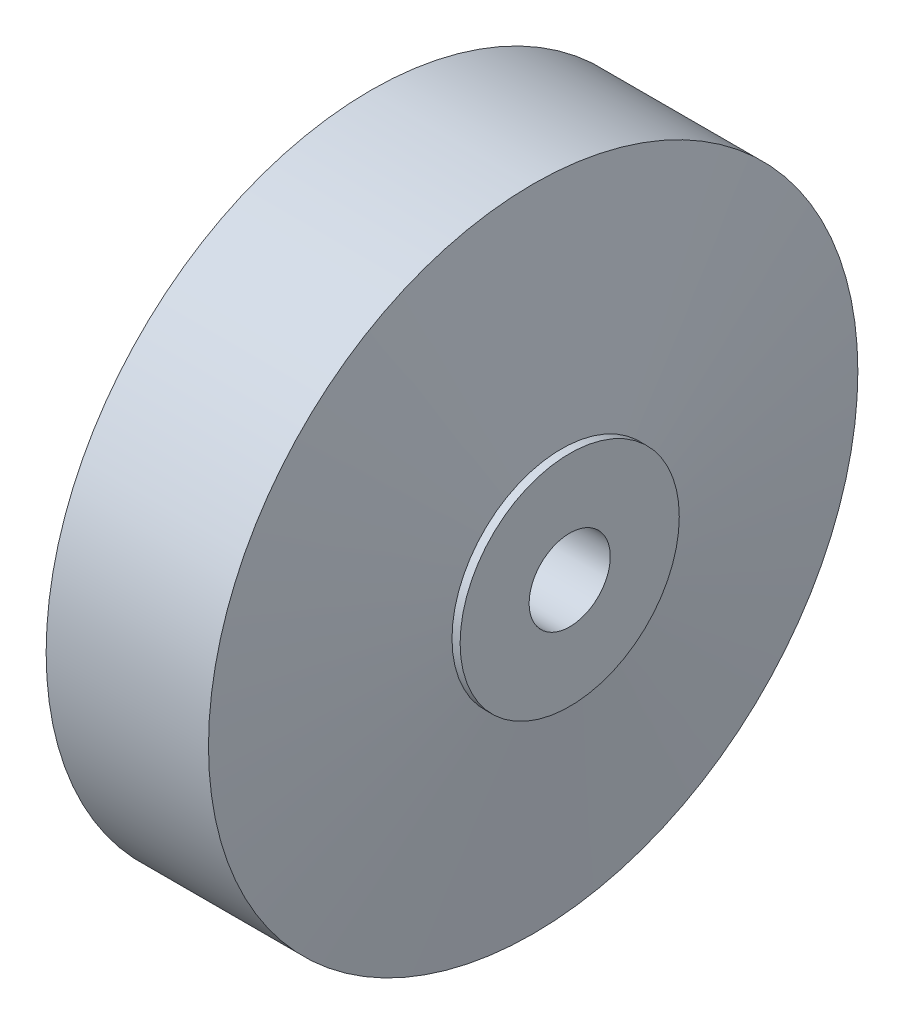
from build123d import *


with BuildPart() as part:
    # Esquisse1 → Révolution1 (revolve)
    with BuildSketch(Plane.XY, mode=Mode.PRIVATE) as r_volution1_sk:
        Polygon((-20, 80), (20, 80), (27, 27), (29, 27), (29, 10), (-29, 10), (-29, 27), (-27, 27), align=None)
    revolve(r_volution1_sk.sketch.rotate(Axis((0, 0, 0), (1, 0, 0)), 90), axis=Axis((0, 0, 0), (1, 0, 0)))


solid = part.part
